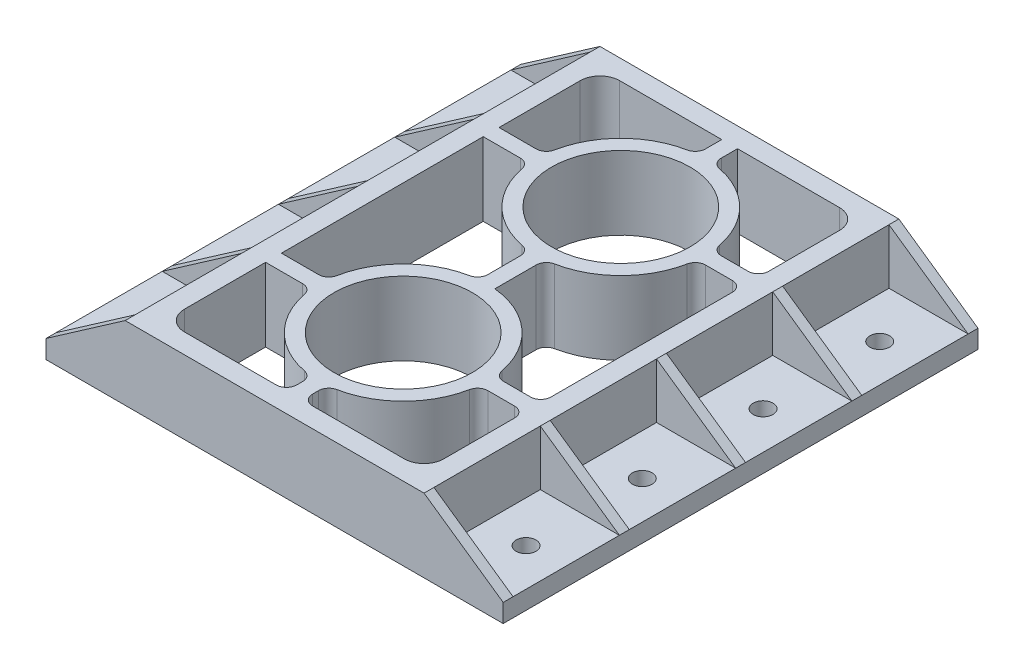
from build123d import *

# Parameters (mm, degrees)
EXTRUDE1_DEPTH        = 152.4
EXTRUDE2_DEPTH        = 3.175
SKETCH8_R             = 3.175
EXTRUDE4_DEPTH        = 191.248536063
LPATTERN1_COUNT       = 5
LPATTERN1_PITCH       = 37.30625
MIRROR5_COPY_1_DEPTH  = 3.175
MIRROR5_COPY_2_DEPTH  = 3.175
MIRROR5_COPY_3_DEPTH  = 3.175
MIRROR5_COPY_4_DEPTH  = 3.175
EXTRUDE5_DEPTH        = 25.4
EXTRUDE_THIN2_START   = -23.563494
SKETCH12_R            = 26.9875
SKETCH12_R_2          = 22.225
EXTRUDE_THIN2_DEPTH   = 23.563494
EXTRUDE_THIN2_2_DEPTH = 23.563494
SKETCH13_W            = 17.78
SKETCH13_H            = 5.08
SKETCH13_W_2          = 5.08
SKETCH13_H_2          = 13.97
SKETCH13_H_3          = 20.32
SKETCH13_W_3          = 19.05
SKETCH13_W_4          = 16.51
SKETCH13_H_4          = 12.685889217
SKETCH13_W_5          = 15.24
EXTRUDE6_DEPTH        = 23.563494
FILLET1_R             = 3.302


with BuildPart() as part:
    # Sketch1 → Extrude1 (new body)
    with BuildSketch(Plane.XY):
        Polygon((39.132231405, 0), (112.500773126, 0), (112.500773126, 5.890873545), (87.100773126, 5.890873545), (87.100773126, 23.563494179), (39.132231405, 23.563494179), align=None)
    extrude1 = extrude(amount=-EXTRUDE1_DEPTH)

    # Mirror1: Extrude1 across plane
    add(extrude1.mirror(Plane(origin=(39.132231405, 23.563494179, -152.4), x_dir=(0, 0, 1), z_dir=(-1, 0, 0))))

    # Sketch6 → Extrude2 (add)
    with BuildSketch(Plane.XY):
        Polygon((87.100773126, 23.563494179), (112.500773126, 5.890873545), (87.100773126, 5.890873545), align=None)
    extrude2 = extrude(amount=-EXTRUDE2_DEPTH)

    # Sketch8 → Extrude4 (cut, through all)
    with BuildSketch(Plane(origin=(0, 5.890873545, 0), x_dir=(-1, 0, 0), z_dir=(0, 1, 0))):
        with Locations((-100.395913074, -19.446875)):
            Circle(SKETCH8_R)
        with Locations((-100.395913074, -56.753125)):
            Circle(SKETCH8_R)
        with Locations((-100.395913074, -95.518958881)):
            Circle(SKETCH8_R)
        with Locations((-100.395913074, -132.953125)):
            Circle(SKETCH8_R)
    extrude4 = extrude(amount=-EXTRUDE4_DEPTH, mode=Mode.SUBTRACT)

    # LPattern1: Extrude2 ×5
    with Locations(*[(0, 0, -i * LPATTERN1_PITCH) for i in range(1, LPATTERN1_COUNT)]):
        add(extrude2)

    # Mirror5: Extrude2, Extrude4 across plane
    add(extrude2.mirror(Plane(origin=(39.132231405, 0, 0), x_dir=(0, 0, 1), z_dir=(1, 0, 0))))
    add(extrude4.mirror(Plane(origin=(39.132231405, 0, 0), x_dir=(0, 0, 1), z_dir=(1, 0, 0))), mode=Mode.SUBTRACT)

    # Mirror5 copy 1 sketch → Mirror5 copy 1 (add)
    with BuildSketch(Plane(origin=(78.264462809, 0, -37.30625), x_dir=(-1, 0, 0), z_dir=(0, 0, 1))):
        Polygon((87.100773126, -23.563494179), (112.500773126, -5.890873545), (87.100773126, -5.890873545), align=None)
    extrude(amount=-MIRROR5_COPY_1_DEPTH)

    # Mirror5 copy 2 sketch → Mirror5 copy 2 (add)
    with BuildSketch(Plane(origin=(78.264462809, 0, -74.6125), x_dir=(-1, 0, 0), z_dir=(0, 0, 1))):
        Polygon((87.100773126, -23.563494179), (112.500773126, -5.890873545), (87.100773126, -5.890873545), align=None)
    extrude(amount=-MIRROR5_COPY_2_DEPTH)

    # Mirror5 copy 3 sketch → Mirror5 copy 3 (add)
    with BuildSketch(Plane(origin=(78.264462809, 0, -111.91875), x_dir=(-1, 0, 0), z_dir=(0, 0, 1))):
        Polygon((87.100773126, -23.563494179), (112.500773126, -5.890873545), (87.100773126, -5.890873545), align=None)
    extrude(amount=-MIRROR5_COPY_3_DEPTH)

    # Mirror5 copy 4 sketch → Mirror5 copy 4 (add)
    with BuildSketch(Plane(origin=(78.264462809, 0, -149.225), x_dir=(-1, 0, 0), z_dir=(0, 0, 1))):
        Polygon((87.100773126, -23.563494179), (112.500773126, -5.890873545), (87.100773126, -5.890873545), align=None)
    extrude(amount=-MIRROR5_COPY_4_DEPTH)

    # Sketch11 → Extrude5 (cut)
    with BuildSketch(Plane(origin=(0, 23.563494179, 0), x_dir=(-1, 0, 0), z_dir=(0, 1, 0))):
        with BuildLine():
            Line((-80.750773126, -139.7), (-80.750773126, -12.7))
            ThreePointArc((-80.750773126, -12.7), (-78.890901187, -8.209871939), (-74.400773126, -6.35))
            Line((-74.400773126, -6.35), (-3.863689683, -6.35))
            ThreePointArc((-3.863689683, -6.35), (0.626438378, -8.209871939), (2.486310317, -12.7))
            Line((2.486310317, -12.7), (2.486310317, -139.7))
            ThreePointArc((2.486310317, -139.7), (0.626438378, -144.190128061), (-3.863689683, -146.05))
            Line((-3.863689683, -146.05), (-74.400773126, -146.05))
            ThreePointArc((-74.400773126, -146.05), (-78.890901187, -144.190128061), (-80.750773126, -139.7))
        make_face()
    extrude(amount=-EXTRUDE5_DEPTH, mode=Mode.SUBTRACT)



with BuildPart() as body_2:
    # Sketch12 → Extrude-Thin2 (new body)
    with BuildSketch(Plane(origin=(0, 23.563494179, 0), x_dir=(-1, 0, 0), z_dir=(0, 1, 0)).offset(EXTRUDE_THIN2_START)):
        with Locations((-39.132231405, -41.275)):
            Circle(SKETCH12_R)
        with Locations((-39.132231405, -41.275)):
            Circle(SKETCH12_R_2, mode=Mode.SUBTRACT)
    extrude(amount=EXTRUDE_THIN2_DEPTH)


with BuildPart() as body_3:
    # Sketch12 → Extrude-Thin2 2 (new body)
    with BuildSketch(Plane(origin=(0, 23.563494179, 0), x_dir=(-1, 0, 0), z_dir=(0, 1, 0)).offset(EXTRUDE_THIN2_START)):
        with Locations((-39.132231405, -111.125)):
            Circle(SKETCH12_R)
        with Locations((-39.132231405, -111.125)):
            Circle(SKETCH12_R_2, mode=Mode.SUBTRACT)
    extrude(amount=EXTRUDE_THIN2_2_DEPTH)


with BuildPart() as part_1:
    add(part.part)

    add(body_2.part)  # Extrude6 merges body 2

    add(body_3.part)  # Extrude6 merges body 3
    # Sketch13 → Extrude6 (add)
    with BuildSketch(Plane(origin=(0, 23.563494179, 0), x_dir=(-1, 0, 0), z_dir=(0, 1, 0))):
        with Locations((-71.860773126, -41.275)):
            Rectangle(SKETCH13_W, SKETCH13_H)
        with Locations((-39.132231405, -9.8425)):
            Rectangle(SKETCH13_W_2, SKETCH13_H_2)
        with Locations((-39.132231405, -76.5175)):
            Rectangle(SKETCH13_W_2, SKETCH13_H_3)
        with Locations((-5.159731405, -41.275)):
            Rectangle(SKETCH13_W_3, SKETCH13_H)
        with Locations((-5.337623018, -111.125)):
            Rectangle(SKETCH13_W_4, SKETCH13_H)
        with Locations((-39.132231405, -142.266392139)):
            Rectangle(SKETCH13_W_2, SKETCH13_H_4)
        with Locations((-73.130773126, -111.125)):
            Rectangle(SKETCH13_W_5, SKETCH13_H)
    extrude(amount=-EXTRUDE6_DEPTH)

    # Fillet1
    fillet1_edges = [part_1.edges().sort_by_distance(p)[0] for p in [
        (36.592231405, 11.781747179, -6.35),
        (41.672231405, 11.781747179, -6.35),
        (36.592231405, 11.781747179, -14.407295292),
        (41.672231405, 11.781747179, -14.407295292),
        (36.592231405, 11.781747179, -68.142704708),
        (36.592231405, 11.781747179, -84.257295292),
        (41.672231405, 11.781747179, -84.257295292),
        (41.672231405, 11.781747179, -137.992704708),
        (36.592231405, 11.781747179, -137.992704708),
        (12.264526697, 11.781747179, -108.585),
        (12.264526697, 11.781747179, -113.665),
        (65.999936112, 11.781747179, -113.665),
        (65.999936112, 11.781747179, -108.585),
        (80.750773126, 11.781747179, -113.665),
        (80.750773126, 11.781747179, -108.585),
        (12.264526697, 11.781747179, -38.735),
        (12.264526697, 11.781747179, -43.815),
        (65.999936112, 11.781747179, -43.815),
        (80.750773126, 11.781747179, -43.815),
        (65.999936112, 11.781747179, -38.735),
        (80.750773126, 11.781747179, -38.735),
    ]]
    fillet(fillet1_edges, radius=FILLET1_R)


solid = part_1.part
